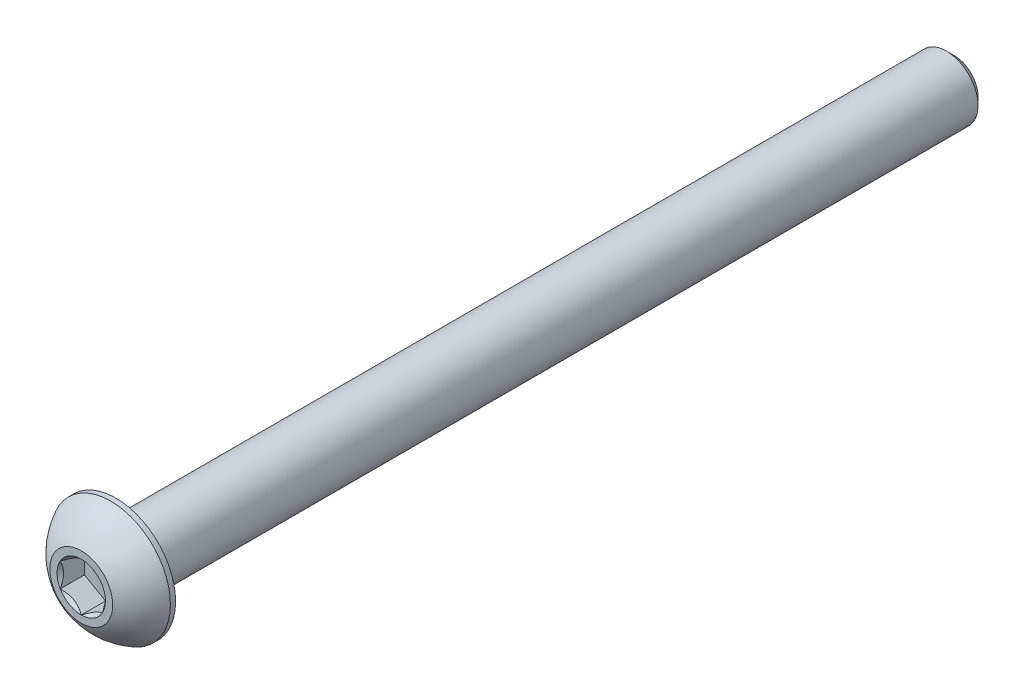
from build123d import *

# Parameters (mm, degrees)
SKETCH1_W          = 40
SKETCH1_H          = 1.5
CHAMFER1_SIZE      = 0.375
CUT_EXTRUDE2_DEPTH = 1.155


with BuildPart() as part:
    # Sketch1 → Revolve1 (revolve)
    with BuildSketch(Plane(origin=(0, 0, 0), x_dir=(0, 0, -1), z_dir=(1, 0, 0))):
        with Locations((21.65, 0.75)):
            Rectangle(SKETCH1_W, SKETCH1_H)
    revolve(axis=Axis((0, 0, -41.65), (0, 0, 1)))

    # Chamfer1
    chamfer1_edges = [part.edges().sort_by_distance(p)[0] for p in [
        (0, -1.5, -41.65),
    ]]
    chamfer(chamfer1_edges, length=CHAMFER1_SIZE)

    # Sketch7 → Revolve2 (revolve)
    with BuildSketch(Plane(origin=(0, 0, 0), x_dir=(0, 0, -1), z_dir=(1, 0, 0)), mode=Mode.PRIVATE) as revolve2_sk:
        with BuildLine():
            Line((1.4025, 2.85), (1.65, 2.85))
            Line((1.65, 2.85), (1.65, 0))
            Line((1.65, 0), (0, 0))
            Line((0, 0), (0, 1.5))
            ThreePointArc((0, 1.5), (0.59512511, 2.285251969), (1.4025, 2.85))
        make_face()
    revolve(revolve2_sk.sketch.rotate(Axis((0, 0, 0), (0, 0, -1)), 180), axis=Axis((0, 0, 0), (0, 0, -1)))

    # Sketch5 → Cut-Extrude2 (cut)
    with BuildSketch(Plane.XY):
        Polygon((1, -0.577350269), (1, 0.577350269), (0, 1.154700538), (-1, 0.577350269), (-1, -0.577350269), (0, -1.154700538), align=None)
    extrude(amount=-CUT_EXTRUDE2_DEPTH, mode=Mode.SUBTRACT)

    # Cut-Extrude3 cone 1 section (through the dimple's axis) → Cut-Extrude3 (revolve, cut)
    with BuildSketch(Plane(origin=(0, 0, 0), x_dir=(0, -1, 0), z_dir=(1, 0, 0))):
        Polygon((0, 0), (1.154700538, 0), (0, 1.154700538), align=None)
    revolve(axis=Axis((0, 0, 0), (0, 0, -1)), mode=Mode.SUBTRACT)


solid = part.part
